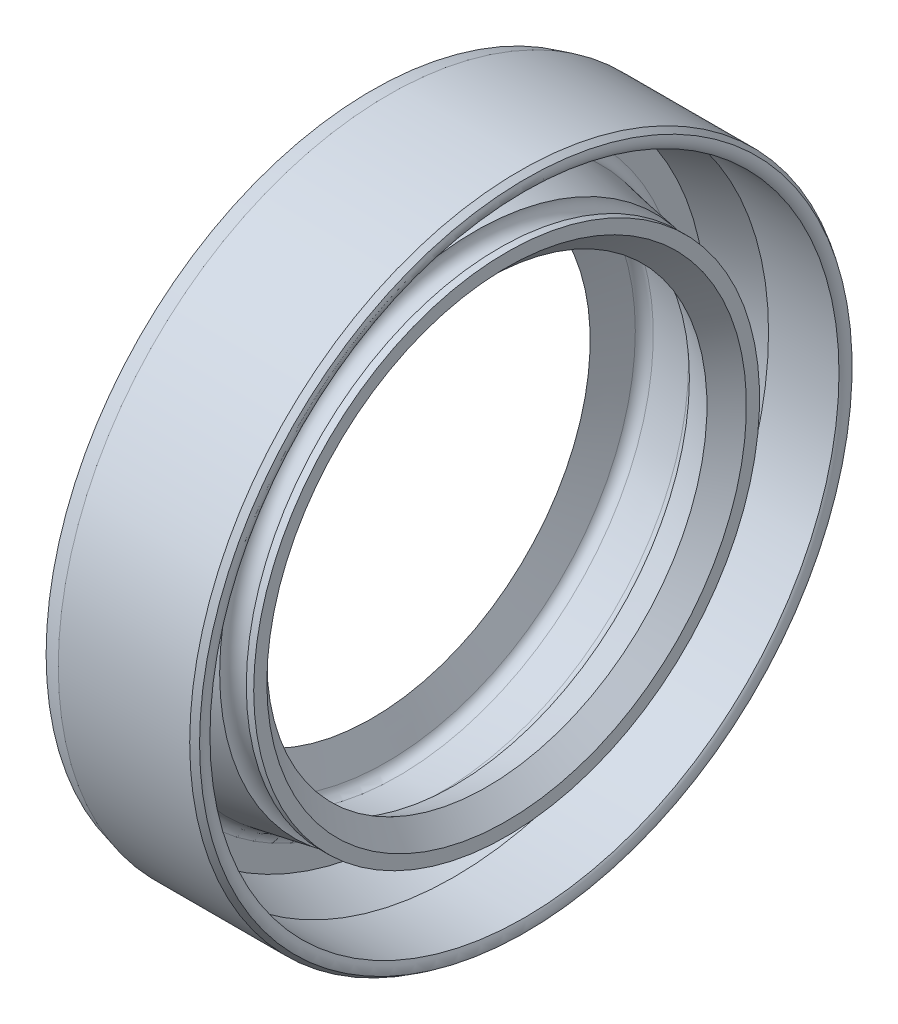
from build123d import *


with BuildPart() as part:
    # Skica1 → Rotovat1 (revolve)
    with BuildSketch(Plane(origin=(0, 0, 0), x_dir=(1, 0, 0), z_dir=(0, 1, 0)), mode=Mode.PRIVATE) as rotovat1_sk:
        with BuildLine():
            Line((0.752354754, 15), (0, 14.799766338))
            Line((0, 14.799766338), (0, 12.252974848))
            Line((0, 12.252974848), (0, 9.924742436))
            Line((0, 9.924742436), (0.659888848, 11.315677616))
            ThreePointArc((0.659888848, 11.315677616), (0.882229098, 11.545632518), (1.198453009, 11.59376652))
            Line((1.198453009, 11.59376652), (3.141311462, 11.251188155))
            ThreePointArc((3.141311462, 11.251188155), (3.520859186, 11.062097088), (3.736411004, 10.696926826))
            Line((3.736411004, 10.696926826), (5.230975406, 10))
            Line((5.230975406, 10), (6.127714047, 10.896738641))
            Line((6.127714047, 10.896738641), (6.127714047, 11.494564402))
            Line((6.127714047, 11.494564402), (5.791437057, 11.494564402))
            ThreePointArc((5.791437057, 11.494564402), (5.181359836, 10.935150578), (4.679262436, 11.593205471))
            Line((4.679262436, 11.593205471), (1.935648693, 12.076978598))
            ThreePointArc((1.935648693, 12.076978598), (1.619443561, 12.259539716), (1.494564402, 12.602642387))
            Line((1.494564402, 12.602642387), (1.494564402, 13.692193125))
            Line((1.494564402, 13.692193125), (3.736411004, 14.292894111))
            Line((3.736411004, 14.292894111), (6.939049008, 14.292894111))
            ThreePointArc((6.939049008, 14.292894111), (7.04157399, 14.551553355), (7, 14.826667112))
            Line((7, 14.826667112), (6.725539808, 15))
            Line((6.725539808, 15), (0.752354754, 15))
        make_face()
    revolve(rotovat1_sk.sketch.rotate(Axis((-19.456594072, 0, 0), (1, 0, 0)), 180), axis=Axis((-19.456594072, 0, 0), (1, 0, 0)))


solid = part.part
